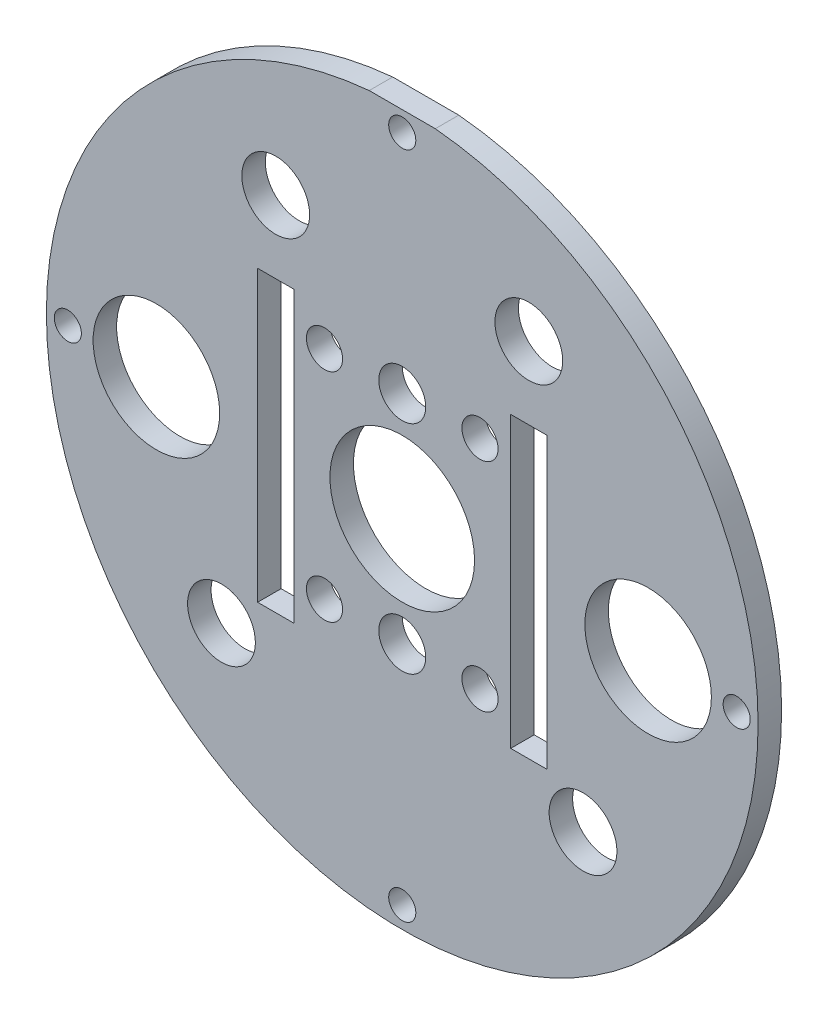
from build123d import *

# Parameters (mm, degrees)
SKETCH_1_R          = 50
EXTRUDE_1_DEPTH     = 3.302
SKETCH_2_R          = 4.7625
CUT_EXTRUDE_1_DEPTH = 71.787733429
SKETCH_4_R          = 10.16
CUT_EXTRUDE_3_DEPTH = 71.787733429
SKETCH_3_W          = 9.285115832
SKETCH_3_H          = 8.046477463
CUT_EXTRUDE_2_DEPTH = 71.787733429
SKETCH_8_R          = 8.89
SKETCH_8_W          = 5.08
SKETCH_8_H          = 40.64
CUT_EXTRUDE_4_DEPTH = 71.787733429
SKETCH_9_R          = 2.54
SKETCH_9_R_2        = 3.302
CUT_EXTRUDE_5_DEPTH = 71.787733429
SKETCH_10_R         = 1.905
CUT_EXTRUDE_6_DEPTH = 71.787733429


with BuildPart() as part:
    # 草图1 → 凸台-拉伸1 (new body)
    with BuildSketch(Plane.XY):
        with Locations(Location((0, 0, 0), (0, 0, 180))):
            Circle(SKETCH_1_R)
    extrude(amount=EXTRUDE_1_DEPTH)

    # 草图2 → 切除-拉伸1 (cut, through all)
    with BuildSketch(Plane.XY.offset(3.302)):
        with Locations((-17.78, 30.48)):
            Circle(SKETCH_2_R)
        with Locations((-25.4, -25.4)):
            Circle(SKETCH_2_R)
        with Locations((25.4, -25.4)):
            Circle(SKETCH_2_R)
        with Locations((17.78, 30.48)):
            Circle(SKETCH_2_R)
    extrude(amount=-CUT_EXTRUDE_1_DEPTH, mode=Mode.SUBTRACT)

    # 草图4 → 切除-拉伸3 (cut, through all)
    with BuildSketch(Plane.XY.offset(3.302)):
        Circle(SKETCH_4_R)
    extrude(amount=-CUT_EXTRUDE_3_DEPTH, mode=Mode.SUBTRACT)

    # 草图3 → 切除-拉伸2 (cut, through all)
    with BuildSketch(Plane.XY.offset(3.302)):
        with Locations((0, 53.807238732)):
            Rectangle(SKETCH_3_W, SKETCH_3_H)
    extrude(amount=-CUT_EXTRUDE_2_DEPTH, mode=Mode.SUBTRACT)

    # 草图8 → 切除-拉伸4 (cut, through all)
    with BuildSketch(Plane.XY.offset(3.302)):
        with Locations((34.544, 0)):
            Circle(SKETCH_8_R)
        with Locations((-34.544, 0)):
            Circle(SKETCH_8_R)
        with Locations((17.78, 0)):
            Rectangle(SKETCH_8_W, SKETCH_8_H)
        with Locations((-17.78, 0)):
            Rectangle(SKETCH_8_W, SKETCH_8_H)
    extrude(amount=-CUT_EXTRUDE_4_DEPTH, mode=Mode.SUBTRACT)

    # 草图9 → 切除-拉伸5 (cut, through all)
    with BuildSketch(Plane.XY.offset(3.302)):
        with Locations((-10.922, 15.24)):
            Circle(SKETCH_9_R)
        with Locations((10.922, 15.24)):
            Circle(SKETCH_9_R)
        with Locations((-10.922, -15.24)):
            Circle(SKETCH_9_R)
        with Locations((10.922, -15.24)):
            Circle(SKETCH_9_R)
        with Locations((0, 15.24)):
            Circle(SKETCH_9_R_2)
        with Locations((0, -15.24)):
            Circle(SKETCH_9_R_2)
    extrude(amount=-CUT_EXTRUDE_5_DEPTH, mode=Mode.SUBTRACT)

    # 草图10 → 切除-拉伸6 (cut, through all)
    with BuildSketch(Plane.XY.offset(3.302)):
        with Locations((0, 46.99)):
            Circle(SKETCH_10_R)
        with Locations((46.99, 0)):
            Circle(SKETCH_10_R)
        with Locations((0, -46.99)):
            Circle(SKETCH_10_R)
        with Locations((-46.99, 0)):
            Circle(SKETCH_10_R)
    extrude(amount=-CUT_EXTRUDE_6_DEPTH, mode=Mode.SUBTRACT)


solid = part.part
